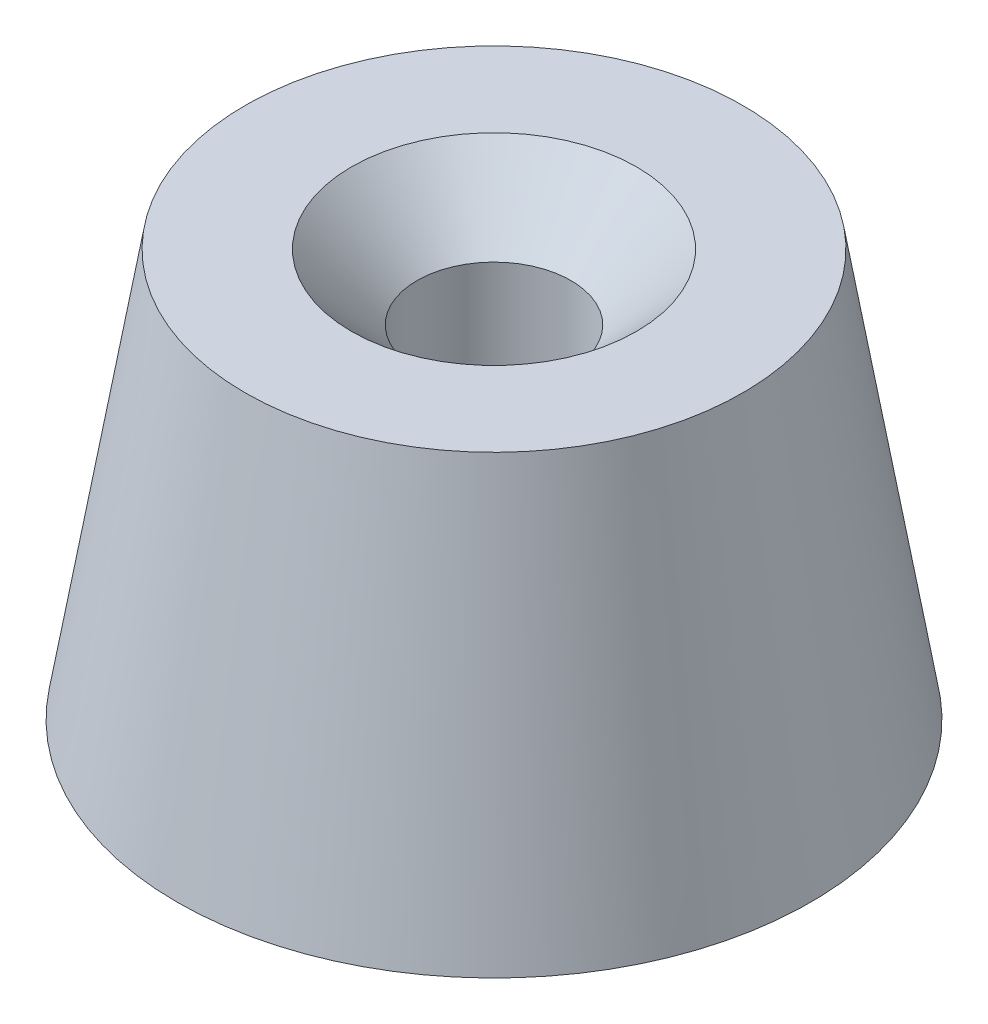
from build123d import *

# Parameters (mm, degrees)
SKETCH2_R                                       = 5.5
SKETCH1_R                                       = 7
CSK_FOR_M3_FLAT_HEAD_MACHINE_SCREW1_D           = 3.4
CSK_FOR_M3_FLAT_HEAD_MACHINE_SCREW1_CSINK_D     = 6.3
CSK_FOR_M3_FLAT_HEAD_MACHINE_SCREW1_CSINK_ANGLE = 90


with BuildPart() as part:
    # Sketch2 → Loft1 section 0
    with BuildSketch(Plane(origin=(0, 9, 0), x_dir=(1, 0, 0), z_dir=(0, 1, 0))):
        Circle(SKETCH2_R)
    # Sketch1 → Loft1 section 1
    with BuildSketch(Plane(origin=(0, 0, 0), x_dir=(1, 0, 0), z_dir=(0, 1, 0))):
        Circle(SKETCH1_R)
    loft()

    # CSK for M3 Flat Head Machine Screw1 (through all)
    with Locations(Plane(origin=(0, 9, 0), x_dir=(1, 0, 0), z_dir=(0, 1, 0))):
        with Locations((0, 0)):
            CounterSinkHole(CSK_FOR_M3_FLAT_HEAD_MACHINE_SCREW1_D / 2, CSK_FOR_M3_FLAT_HEAD_MACHINE_SCREW1_CSINK_D / 2, counter_sink_angle=CSK_FOR_M3_FLAT_HEAD_MACHINE_SCREW1_CSINK_ANGLE)


solid = part.part
